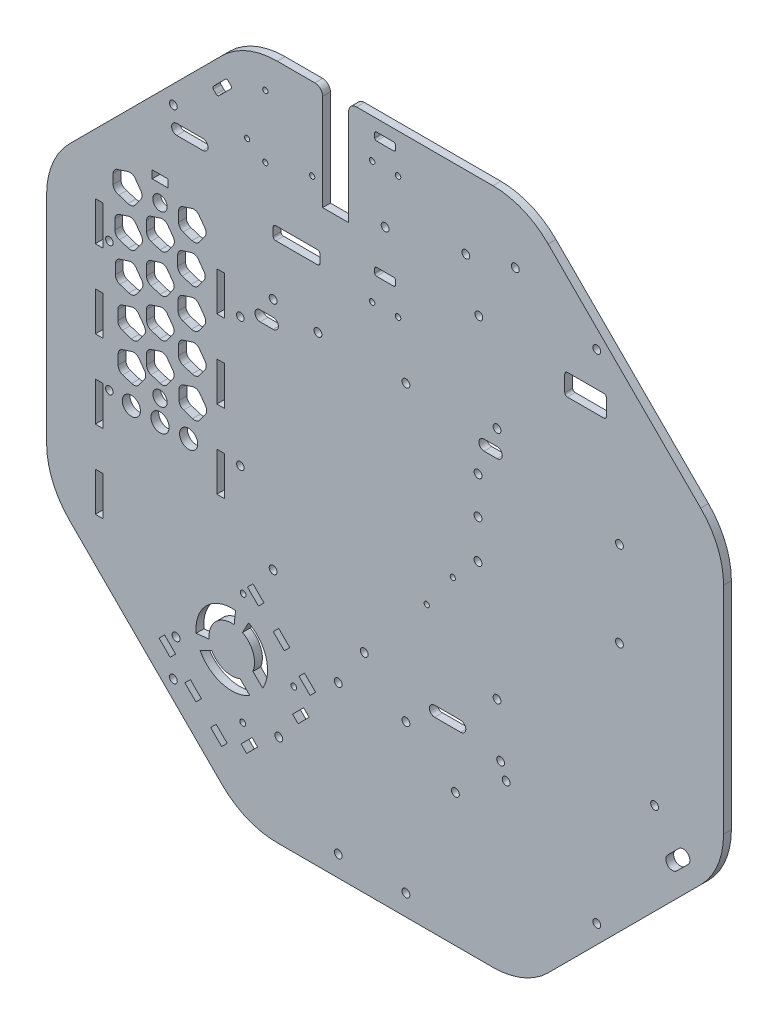
from build123d import *

# Parameters (mm, degrees)
BOSS_EXTRUDE1_DEPTH = 3
SKETCH2_R           = 1.1
SKETCH2_R_2         = 1.5
SKETCH2_R_3         = 2.75
SKETCH2_R_4         = 1.05
SKETCH2_R_5         = 3.5
SKETCH2_W           = 3
SKETCH2_H           = 15
SKETCH2_W_2         = 6
SKETCH2_H_2         = 3
SKETCH2_W_3         = 10
SKETCH2_H_3         = 42
CUT_EXTRUDE2_DEPTH  = 10
FILLET1_R           = 3
SKETCH4_R           = 1.45
SKETCH4_R_2         = 1.5
SKETCH4_W           = 16
SKETCH4_H           = 8.2
SKETCH4_W_2         = 18
SKETCH4_H_2         = 5
CUT_EXTRUDE3_DEPTH  = 10
FILLET2_R           = 1
SKETCH5_R           = 1.5
CUT_EXTRUDE4_DEPTH  = 10
SKETCH6_R           = 1.5
SKETCH6_R_2         = 1
SKETCH6_W           = 8
SKETCH6_H           = 3
CUT_EXTRUDE5_DEPTH  = 10
FILLET3_R           = 1
FILLET4_R           = 0.7


with BuildPart() as part:
    # Sketch1 → Boss-Extrude1 (new body)
    with BuildSketch(Plane.XY):
        with BuildLine():
            Line((130, 17.5), (130, 41.421356237))
            ThreePointArc((130, 41.421356237), (127.716385975, 52.901859208), (121.213203436, 62.634559673))
            Line((121.213203436, 62.634559673), (62.634559673, 121.213203436))
            ThreePointArc((62.634559673, 121.213203436), (52.901859208, 127.716385975), (41.421356237, 130))
            Line((41.421356237, 130), (-41.421356237, 130))
            ThreePointArc((-41.421356237, 130), (-52.901859208, 127.716385975), (-62.634559673, 121.213203436))
            Line((-62.634559673, 121.213203436), (-121.213203436, 62.634559673))
            ThreePointArc((-121.213203436, 62.634559673), (-127.716385975, 52.901859208), (-130, 41.421356237))
            Line((-130, 41.421356237), (-130, 17.5))
            Line((-130, 17.5), (-130, -17.5))
            Line((-130, -17.5), (-130, -41.421356237))
            ThreePointArc((-130, -41.421356237), (-127.716385975, -52.901859208), (-121.213203436, -62.634559673))
            Line((-121.213203436, -62.634559673), (-62.634559673, -121.213203436))
            ThreePointArc((-62.634559673, -121.213203436), (-52.901859208, -127.716385975), (-41.421356237, -130))
            Line((-41.421356237, -130), (41.421356237, -130))
            ThreePointArc((41.421356237, -130), (52.901859208, -127.716385975), (62.634559673, -121.213203436))
            Line((62.634559673, -121.213203436), (121.213203436, -62.634559673))
            ThreePointArc((121.213203436, -62.634559673), (127.716385975, -52.901859208), (130, -41.421356237))
            Line((130, -41.421356237), (130, -17.5))
            Line((130, -17.5), (130, 17.5))
        make_face()
    extrude(amount=BOSS_EXTRUDE1_DEPTH)

    # Sketch2 → Cut-Extrude2 (cut)
    with BuildSketch(Plane.XY):
        with Locations(Location((-80.297278263, -80.932744107, 0), (0, 0, 180))):
            Circle(SKETCH2_R)
        with Locations(Location((-54.662677973, -96.66784946, 0), (0, 0, 180))):
            Circle(SKETCH2_R)
        with Locations(Location((-54.521233727, -53.675780054, 0), (0, 0, 180))):
            Circle(SKETCH2_R)
        with Locations(Location((-35.075797244, -74.818272812, 0), (0, 0, 180))):
            Circle(SKETCH2_R)
        with Locations((-40.840719873, -94.509194306)):
            Circle(SKETCH2_R_2)
        with Locations((-86.456902055, -4.634633752)):
            Circle(SKETCH2_R_3)
        with Locations((-86.456902055, 60.347906666)):
            Circle(SKETCH2_R_3)
        with Locations((4.98, 115)):
            Circle(SKETCH2_R_4)
        with Locations(Location((-4.98, 115, 0), (0, 0, 180))):
            Circle(SKETCH2_R_4)
        with Locations((-4.98, 68.1)):
            Circle(SKETCH2_R_4)
        with Locations(Location((4.98, 68.1, 0), (0, 0, 180))):
            Circle(SKETCH2_R_4)
        with Locations((-97.456902055, -12.652093334)):
            Circle(SKETCH2_R_5)
        with Locations((-75.456902055, -12.652093334)):
            Circle(SKETCH2_R_5)
        with Locations((-86.456902055, -12.652093334)):
            Circle(SKETCH2_R_5)
        with Locations((-63.132453333, 41.847906666)):
            Rectangle(SKETCH2_W, SKETCH2_H)
        with BuildLine():
            Line((-67.578985216, -75.346961612), (-72.551594693, -75.869603929))
            ThreePointArc((-72.551594693, -75.869603929), (-68.601930443, -64.711913429), (-57.446104843, -60.756984843))
            Line((-57.446104843, -60.756984843), (-57.96874725, -65.729595189))
            ThreePointArc((-57.96874725, -65.729595189), (-65.066396383, -68.24744749), (-67.578985216, -75.346961612))
        make_face()
        with BuildLine():
            Line((-66.602710069, -78.540213733), (-71.017448033, -80.887571547))
            ThreePointArc((-71.017448033, -80.887571547), (-62.624240554, -87.661852985), (-51.925173802, -86.295547235))
            Line((-51.925173802, -86.295547235), (-55.653687393, -82.567033643))
            ThreePointArc((-55.653687393, -82.567033643), (-61.897197051, -82.644549092), (-66.602710069, -78.540213733))
        make_face()
        with BuildLine():
            Line((-50.742222547, -77.655568797), (-47.013708955, -81.384082388))
            ThreePointArc((-47.013708955, -81.384082388), (-45.647403205, -70.685015636), (-52.421684643, -62.291808157))
            Line((-52.421684643, -62.291808157), (-54.769042457, -66.706546121))
            ThreePointArc((-54.769042457, -66.706546121), (-50.664707098, -71.412059139), (-50.742222547, -77.655568797))
        make_face()
        Polygon((-53.215088544, -106.176456195), (-55.336408887, -104.055135852), (-51.0937682, -99.812495165), (-48.972447856, -101.933815508), align=None)
        Polygon((-31.294778327, -80.013505292), (-35.537419014, -84.256145979), (-33.41609867, -86.377466322), (-29.173457983, -82.134825635), align=None)
        Polygon((-62.76103009, -108.65132993), (-60.639709746, -106.530009586), (-64.882350433, -102.287368899), (-67.003670777, -104.408689243), align=None)
        Polygon((-72.660525026, -98.751834993), (-76.903165713, -94.509194306), (-74.78184537, -92.387873962), (-70.539204683, -96.630514649), align=None)
        Polygon((-82.560019963, -88.852340056), (-86.80266065, -84.609699369), (-84.681340306, -82.488379026), (-80.438699619, -86.731019713), align=None)
        Polygon((-40.840719873, -58.400041285), (-42.962040216, -60.521361629), (-38.719399529, -64.764002316), (-36.598079186, -62.642681972), align=None)
        Polygon((-50.740214809, -48.500546348), (-52.861535153, -50.621866692), (-48.618894466, -54.864507379), (-46.497574122, -52.743187036), align=None)
        Polygon((-30.941224936, -68.299536222), (-33.06254528, -70.420856565), (-28.819904593, -74.663497252), (-26.698584249, -72.542176909), align=None)
        with Locations((-86.456902055, 68.347906666)):
            Rectangle(SKETCH2_W_2, SKETCH2_H_2)
        with Locations((-109.781350777, 41.847906666)):
            Rectangle(SKETCH2_W, SKETCH2_H)
        with Locations((-109.781350777, 11.847906666)):
            Rectangle(SKETCH2_W, SKETCH2_H)
        with Locations((-109.781350777, -18.152093334)):
            Rectangle(SKETCH2_W, SKETCH2_H)
        with Locations((-109.781350777, -48.152093334)):
            Rectangle(SKETCH2_W, SKETCH2_H)
        with Locations((-63.132453333, 11.847906666)):
            Rectangle(SKETCH2_W, SKETCH2_H)
        with Locations((-63.132453333, -18.152093334)):
            Rectangle(SKETCH2_W, SKETCH2_H)
        with BuildLine():
            Line((-93.838836996, 60.750802244), (-95.974091911, 63.689728506))
            ThreePointArc((-95.974091911, 63.689728506), (-97.224091911, 64.597906666), (-98.769176883, 64.597906666))
            Line((-98.769176883, 64.597906666), (-102.224091911, 63.475336724))
            ThreePointArc((-102.224091911, 63.475336724), (-103.785893768, 62.702847203), (-104.46372332, 61.097695434))
            Line((-104.46372332, 61.097695434), (-104.46372332, 57.464982794))
            ThreePointArc((-104.46372332, 57.464982794), (-103.790493058, 55.863487753), (-102.236265805, 55.087341503))
            Line((-102.236265805, 55.087341503), (-98.781350777, 53.964771561))
            ThreePointArc((-98.781350777, 53.964771561), (-97.236265805, 53.964771561), (-95.986265805, 54.872949721))
            Line((-95.986265805, 54.872949721), (-93.85101089, 57.811875983))
            ThreePointArc((-93.85101089, 57.811875983), (-93.367461365, 59.279361324), (-93.838836996, 60.750802244))
        make_face()
        with BuildLine():
            Line((-93.668638348, 45.96766714), (-95.803893263, 48.906593401))
            ThreePointArc((-95.803893263, 48.906593401), (-97.053893263, 49.814771561), (-98.598978235, 49.814771561))
            Line((-98.598978235, 49.814771561), (-102.053893263, 48.69220162))
            ThreePointArc((-102.053893263, 48.69220162), (-103.303893263, 47.78402346), (-103.781350777, 46.314560329))
            Line((-103.781350777, 46.314560329), (-103.781350777, 42.681847689))
            ThreePointArc((-103.781350777, 42.681847689), (-103.303893263, 41.212384559), (-102.053893263, 40.304206399))
            Line((-102.053893263, 40.304206399), (-98.598978235, 39.181636457))
            ThreePointArc((-98.598978235, 39.181636457), (-97.053893263, 39.181636457), (-95.803893263, 40.089814617))
            Line((-95.803893263, 40.089814617), (-93.668638348, 43.028740879))
            ThreePointArc((-93.668638348, 43.028740879), (-93.191180834, 44.498204009), (-93.668638348, 45.96766714))
        make_face()
        with BuildLine():
            Line((-93.486265805, 31.184532036), (-95.621520721, 34.123458297))
            ThreePointArc((-95.621520721, 34.123458297), (-96.871520721, 35.031636457), (-98.416605693, 35.031636457))
            Line((-98.416605693, 35.031636457), (-101.871520721, 33.909066516))
            ThreePointArc((-101.871520721, 33.909066516), (-103.121520721, 33.000888356), (-103.598978235, 31.531425225))
            Line((-103.598978235, 31.531425225), (-103.598978235, 27.898712585))
            ThreePointArc((-103.598978235, 27.898712585), (-103.121520721, 26.429249454), (-101.871520721, 25.521071294))
            Line((-101.871520721, 25.521071294), (-98.416605693, 24.398501353))
            ThreePointArc((-98.416605693, 24.398501353), (-96.871520721, 24.398501353), (-95.621520721, 25.306679513))
            Line((-95.621520721, 25.306679513), (-93.486265805, 28.245605774))
            ThreePointArc((-93.486265805, 28.245605774), (-93.008808291, 29.715068905), (-93.486265805, 31.184532036))
        make_face()
        with BuildLine():
            Line((-92.531350777, 16.401396931), (-94.666605693, 19.340323193))
            ThreePointArc((-94.666605693, 19.340323193), (-95.916605693, 20.248501353), (-97.461690665, 20.248501353))
            Line((-97.461690665, 20.248501353), (-100.916605693, 19.125931411))
            ThreePointArc((-100.916605693, 19.125931411), (-102.166605693, 18.217753251), (-102.644063207, 16.74829012))
            Line((-102.644063207, 16.74829012), (-102.644063207, 13.11557748))
            ThreePointArc((-102.644063207, 13.11557748), (-102.166605693, 11.64611435), (-100.916605693, 10.73793619))
            Line((-100.916605693, 10.73793619), (-97.461690665, 9.615366248))
            ThreePointArc((-97.461690665, 9.615366248), (-95.916605693, 9.615366248), (-94.666605693, 10.523544408))
            Line((-94.666605693, 10.523544408), (-92.531350777, 13.46247067))
            ThreePointArc((-92.531350777, 13.46247067), (-92.053893263, 14.9319338), (-92.531350777, 16.401396931))
        make_face()
        with BuildLine():
            Line((-92.405382528, 1.620174075), (-94.540637444, 4.559100336))
            ThreePointArc((-94.540637444, 4.559100336), (-95.790637444, 5.467278496), (-97.335722415, 5.467278496))
            Line((-97.335722415, 5.467278496), (-100.790637444, 4.344708555))
            ThreePointArc((-100.790637444, 4.344708555), (-102.040637444, 3.436530395), (-102.518094958, 1.967067264))
            Line((-102.518094958, 1.967067264), (-102.518094958, -1.665645376))
            ThreePointArc((-102.518094958, -1.665645376), (-102.040637444, -3.135108507), (-100.790637444, -4.043286667))
            Line((-100.790637444, -4.043286667), (-97.335722415, -5.165856608))
            ThreePointArc((-97.335722415, -5.165856608), (-95.790637444, -5.165856608), (-94.540637444, -4.257678448))
            Line((-94.540637444, -4.257678448), (-92.405382528, -1.318752187))
            ThreePointArc((-92.405382528, -1.318752187), (-91.927925014, 0.150710944), (-92.405382528, 1.620174075))
        make_face()
        with BuildLine():
            Line((-69.306725976, 60.750802244), (-71.441980891, 63.689728506))
            ThreePointArc((-71.441980891, 63.689728506), (-72.691980891, 64.597906666), (-74.237065863, 64.597906666))
            Line((-74.237065863, 64.597906666), (-77.691980891, 63.475336724))
            ThreePointArc((-77.691980891, 63.475336724), (-78.879962413, 62.543534215), (-79.314825876, 61.097695434))
            Line((-79.314825876, 61.097695434), (-79.314825876, 57.464982794))
            ThreePointArc((-79.314825876, 57.464982794), (-78.837368362, 55.995519663), (-77.587368362, 55.087341503))
            Line((-77.587368362, 55.087341503), (-74.132453333, 53.964771561))
            ThreePointArc((-74.132453333, 53.964771561), (-72.587368362, 53.964771561), (-71.337368362, 54.872949721))
            Line((-71.337368362, 54.872949721), (-69.202113446, 57.811875983))
            ThreePointArc((-69.202113446, 57.811875983), (-68.77658834, 59.298347757), (-69.306725976, 60.750802244))
        make_face()
        with BuildLine():
            Line((-69.56452041, 45.96766714), (-71.699775326, 48.906593401))
            ThreePointArc((-71.699775326, 48.906593401), (-72.949775326, 49.814771561), (-74.494860298, 49.814771561))
            Line((-74.494860298, 49.814771561), (-77.949775326, 48.69220162))
            ThreePointArc((-77.949775326, 48.69220162), (-79.199775326, 47.78402346), (-79.67723284, 46.314560329))
            Line((-79.67723284, 46.314560329), (-79.67723284, 42.681847689))
            ThreePointArc((-79.67723284, 42.681847689), (-79.199775326, 41.212384559), (-77.949775326, 40.304206399))
            Line((-77.949775326, 40.304206399), (-74.494860298, 39.181636457))
            ThreePointArc((-74.494860298, 39.181636457), (-72.949775326, 39.181636457), (-71.699775326, 40.089814617))
            Line((-71.699775326, 40.089814617), (-69.56452041, 43.028740879))
            ThreePointArc((-69.56452041, 43.028740879), (-69.087062896, 44.498204009), (-69.56452041, 45.96766714))
        make_face()
        with BuildLine():
            Line((-69.382147868, 31.184532036), (-71.517402784, 34.123458297))
            ThreePointArc((-71.517402784, 34.123458297), (-72.767402784, 35.031636457), (-74.312487756, 35.031636457))
            Line((-74.312487756, 35.031636457), (-77.767402784, 33.909066516))
            ThreePointArc((-77.767402784, 33.909066516), (-79.017402784, 33.000888356), (-79.494860298, 31.531425225))
            Line((-79.494860298, 31.531425225), (-79.494860298, 27.898712585))
            ThreePointArc((-79.494860298, 27.898712585), (-79.017402784, 26.429249454), (-77.767402784, 25.521071294))
            Line((-77.767402784, 25.521071294), (-74.312487756, 24.398501353))
            ThreePointArc((-74.312487756, 24.398501353), (-72.767402784, 24.398501353), (-71.517402784, 25.306679513))
            Line((-71.517402784, 25.306679513), (-69.382147868, 28.245605774))
            ThreePointArc((-69.382147868, 28.245605774), (-68.904690354, 29.715068905), (-69.382147868, 31.184532036))
        make_face()
        with BuildLine():
            Line((-69.199775326, 16.401396931), (-71.335030242, 19.340323193))
            ThreePointArc((-71.335030242, 19.340323193), (-72.585030242, 20.248501353), (-74.130115214, 20.248501353))
            Line((-74.130115214, 20.248501353), (-77.585030242, 19.125931411))
            ThreePointArc((-77.585030242, 19.125931411), (-78.835030242, 18.217753251), (-79.312487756, 16.74829012))
            Line((-79.312487756, 16.74829012), (-79.312487756, 13.11557748))
            ThreePointArc((-79.312487756, 13.11557748), (-78.835030242, 11.64611435), (-77.585030242, 10.73793619))
            Line((-77.585030242, 10.73793619), (-74.130115214, 9.615366248))
            ThreePointArc((-74.130115214, 9.615366248), (-72.585030242, 9.615366248), (-71.335030242, 10.523544408))
            Line((-71.335030242, 10.523544408), (-69.199775326, 13.46247067))
            ThreePointArc((-69.199775326, 13.46247067), (-68.722317812, 14.9319338), (-69.199775326, 16.401396931))
        make_face()
        with BuildLine():
            Line((-69.017402784, 1.618261827), (-71.1526577, 4.557188088))
            ThreePointArc((-71.1526577, 4.557188088), (-72.4026577, 5.465366248), (-73.947742671, 5.465366248))
            Line((-73.947742671, 5.465366248), (-77.4026577, 4.342796307))
            ThreePointArc((-77.4026577, 4.342796307), (-78.6526577, 3.434618147), (-79.130115214, 1.965155016))
            Line((-79.130115214, 1.965155016), (-79.130115214, -1.667557624))
            ThreePointArc((-79.130115214, -1.667557624), (-78.6526577, -3.137020755), (-77.4026577, -4.045198915))
            Line((-77.4026577, -4.045198915), (-73.947742671, -5.167768856))
            ThreePointArc((-73.947742671, -5.167768856), (-72.4026577, -5.167768856), (-71.1526577, -4.259590696))
            Line((-71.1526577, -4.259590696), (-69.017402784, -1.320664435))
            ThreePointArc((-69.017402784, -1.320664435), (-68.53994527, 0.148798696), (-69.017402784, 1.618261827))
        make_face()
        with BuildLine():
            Line((-81.344189626, 51.500802244), (-83.479444541, 54.439728506))
            ThreePointArc((-83.479444541, 54.439728506), (-84.729444541, 55.347906666), (-86.274529513, 55.347906666))
            Line((-86.274529513, 55.347906666), (-89.729444541, 54.225336724))
            ThreePointArc((-89.729444541, 54.225336724), (-91.088894263, 53.361456818), (-91.639274598, 51.847695434))
            Line((-91.639274598, 51.847695434), (-91.639274598, 48.214982794))
            ThreePointArc((-91.639274598, 48.214982794), (-91.161817083, 46.745519663), (-89.911817084, 45.837341503))
            Line((-89.911817084, 45.837341503), (-86.456902055, 44.714771561))
            ThreePointArc((-86.456902055, 44.714771561), (-84.911817084, 44.714771561), (-83.661817084, 45.622949721))
            Line((-83.661817084, 45.622949721), (-81.526562168, 48.561875983))
            ThreePointArc((-81.526562168, 48.561875983), (-80.95678235, 50.001640403), (-81.344189626, 51.500802244))
        make_face()
        with BuildLine():
            Line((-81.526562168, 36.71766714), (-83.661817084, 39.656593401))
            ThreePointArc((-83.661817084, 39.656593401), (-84.911817084, 40.564771561), (-86.456902055, 40.564771561))
            Line((-86.456902055, 40.564771561), (-89.911817084, 39.44220162))
            ThreePointArc((-89.911817084, 39.44220162), (-91.161817084, 38.53402346), (-91.639274598, 37.064560329))
            Line((-91.639274598, 37.064560329), (-91.639274598, 33.431847689))
            ThreePointArc((-91.639274598, 33.431847689), (-91.161817084, 31.962384559), (-89.911817084, 31.054206399))
            Line((-89.911817084, 31.054206399), (-86.456902055, 29.931636457))
            ThreePointArc((-86.456902055, 29.931636457), (-84.911817084, 29.931636457), (-83.661817084, 30.839814617))
            Line((-83.661817084, 30.839814617), (-81.526562168, 33.778740879))
            ThreePointArc((-81.526562168, 33.778740879), (-81.049104654, 35.248204009), (-81.526562168, 36.71766714))
        make_face()
        with BuildLine():
            Line((-81.526562168, 21.934532036), (-83.661817084, 24.873458297))
            ThreePointArc((-83.661817084, 24.873458297), (-84.911817084, 25.781636457), (-86.456902055, 25.781636457))
            Line((-86.456902055, 25.781636457), (-89.911817084, 24.659066516))
            ThreePointArc((-89.911817084, 24.659066516), (-91.161817084, 23.750888356), (-91.639274598, 22.281425225))
            Line((-91.639274598, 22.281425225), (-91.639274598, 18.648712585))
            ThreePointArc((-91.639274598, 18.648712585), (-91.161817084, 17.179249454), (-89.911817084, 16.271071294))
            Line((-89.911817084, 16.271071294), (-86.456902055, 15.148501353))
            ThreePointArc((-86.456902055, 15.148501353), (-84.911817084, 15.148501353), (-83.661817084, 16.056679513))
            Line((-83.661817084, 16.056679513), (-81.526562168, 18.995605774))
            ThreePointArc((-81.526562168, 18.995605774), (-81.049104654, 20.465068905), (-81.526562168, 21.934532036))
        make_face()
        with BuildLine():
            Line((-81.526562168, 7.151396931), (-83.661817084, 10.090323193))
            ThreePointArc((-83.661817084, 10.090323193), (-84.911817084, 10.998501353), (-86.456902055, 10.998501353))
            Line((-86.456902055, 10.998501353), (-89.911817084, 9.875931411))
            ThreePointArc((-89.911817084, 9.875931411), (-91.161817084, 8.967753251), (-91.639274598, 7.49829012))
            Line((-91.639274598, 7.49829012), (-91.639274598, 3.86557748))
            ThreePointArc((-91.639274598, 3.86557748), (-91.161817084, 2.39611435), (-89.911817084, 1.48793619))
            Line((-89.911817084, 1.48793619), (-86.456902055, 0.365366248))
            ThreePointArc((-86.456902055, 0.365366248), (-84.911817084, 0.365366248), (-83.661817084, 1.273544408))
            Line((-83.661817084, 1.273544408), (-81.526562168, 4.21247067))
            ThreePointArc((-81.526562168, 4.21247067), (-81.049104654, 5.6819338), (-81.526562168, 7.151396931))
        make_face()
        with Locations((-19, 111)):
            Rectangle(SKETCH2_W_3, SKETCH2_H_3)
    extrude(amount=CUT_EXTRUDE2_DEPTH, mode=Mode.SUBTRACT)

    # Fillet1
    fillet1_edges = [part.edges().sort_by_distance(p)[0] for p in [
        (-14, 130, 1.5),
        (-24, 130, 1.5),
    ]]
    fillet(fillet1_edges, radius=FILLET1_R)

    # Sketch4 → Cut-Extrude3 (cut)
    with BuildSketch(Plane.XY.offset(3)):
        with Locations((-105.9, 37.94)):
            Circle(SKETCH4_R)
        with Locations((-55.6, 37.94)):
            Circle(SKETCH4_R)
        with Locations((-105.9, -11.7)):
            Circle(SKETCH4_R)
        with Locations((-55.6, -11.7)):
            Circle(SKETCH4_R)
        with Locations((44.368675668, -59.95260387)):
            Circle(SKETCH4_R_2)
        with Locations((103.498675668, -45.10260387)):
            Circle(SKETCH4_R_2)
        with Locations((77, 78.1)):
            Rectangle(SKETCH4_W, SKETCH4_H)
        with Locations((-34, 72.5)):
            Rectangle(SKETCH4_W_2, SKETCH4_H_2)
    extrude(amount=-CUT_EXTRUDE3_DEPTH, mode=Mode.SUBTRACT)

    # Fillet2
    fillet2_edges = [part.edges().sort_by_distance(p)[0] for p in [
        (-25, 75, 1.5),
        (-25, 70, 1.5),
        (-43, 70, 1.5),
        (-43, 75, 1.5),
    ]]
    fillet(fillet2_edges, radius=FILLET2_R)

    # Sketch5 → Cut-Extrude4 (cut)
    with BuildSketch(Plane.XY.offset(3)):
        with Locations((90, 35)):
            Circle(SKETCH5_R)
        with Locations((90, 2.13)):
            Circle(SKETCH5_R)
        with Locations((-18, -65)):
            Circle(SKETCH5_R)
        with Locations((8, -122)):
            Circle(SKETCH5_R)
        with Locations((-18, -122)):
            Circle(SKETCH5_R)
        with Locations((8, -65)):
            Circle(SKETCH5_R)
        with Locations((46.5, -65.5)):
            Circle(SKETCH5_R)
        with Locations((27, -79)):
            Circle(SKETCH5_R)
        with Locations((-8, -50)):
            Circle(SKETCH5_R)
        with Locations((-80.297278263, -80.932744107)):
            Circle(SKETCH5_R)
        with Locations((8, 47.591465448)):
            Circle(SKETCH5_R)
        with Locations((-25.776936604, 47.591465448)):
            Circle(SKETCH5_R)
        with Locations((35.693959576, 31.269948624)):
            Circle(SKETCH5_R)
        with Locations((35.693959576, 16.992846182)):
            Circle(SKETCH5_R)
        with Locations((35.693959576, 2.13)):
            Circle(SKETCH5_R)
        with BuildLine():
            Line((19, -54), (29, -54))
            ThreePointArc((29, -54), (31, -56), (29, -58))
            Line((29, -58), (19, -58))
            ThreePointArc((19, -58), (17, -56), (19, -54))
        make_face()
        with BuildLine():
            Line((-80, 90), (-70, 90))
            ThreePointArc((-70, 90), (-68, 88), (-70, 86))
            Line((-70, 86), (-80, 86))
            ThreePointArc((-80, 86), (-82, 88), (-80, 90))
        make_face()
    extrude(amount=-CUT_EXTRUDE4_DEPTH, mode=Mode.SUBTRACT)

    # Sketch6 → Cut-Extrude5 (cut)
    with BuildSketch(Plane.XY.offset(3)):
        with Locations((-43, -40)):
            Circle(SKETCH6_R)
        with Locations((-43, 50)):
            Circle(SKETCH6_R)
        with Locations((43, -40)):
            Circle(SKETCH6_R)
        with Locations((43, 50)):
            Circle(SKETCH6_R)
        with Locations((-81.317279836, -95.45941546)):
            Circle(SKETCH6_R)
        with Locations((81.317279836, -95.45941546)):
            Circle(SKETCH6_R)
        with Locations((81.317279836, 95.45941546)):
            Circle(SKETCH6_R)
        with Locations((-81.317279836, 95.45941546)):
            Circle(SKETCH6_R)
        with Locations((16, -22)):
            Circle(SKETCH6_R_2)
        with Locations((26, -8)):
            Circle(SKETCH6_R_2)
        with Locations((31, 102)):
            Circle(SKETCH6_R)
        with Locations((50, 107)):
            Circle(SKETCH6_R)
        with Locations((36, 84)):
            Circle(SKETCH6_R)
        with Locations((-28, 98.5)):
            Circle(SKETCH6_R_2)
        with Locations((-53, 98.5)):
            Circle(SKETCH6_R_2)
        with Locations((-46, 118)):
            Circle(SKETCH6_R_2)
        with Locations((-46, 94)):
            Circle(SKETCH6_R_2)
        with Locations((0, 95.5)):
            Circle(SKETCH6_R)
        Polygon((-58.689862838, 112.429978209), (-64.346717088, 106.773123959), (-66.468037432, 108.894444303), (-60.811183182, 114.551298552), align=None)
        with BuildLine():
            Line((-43, 40), (-48, 40))
            ThreePointArc((-48, 40), (-50, 42), (-48, 44))
            Line((-48, 44), (-43, 44))
            ThreePointArc((-43, 44), (-41, 42), (-43, 40))
        make_face()
        with BuildLine():
            Line((43, 40), (38, 40))
            ThreePointArc((38, 40), (36, 42), (38, 44))
            Line((38, 44), (43, 44))
            ThreePointArc((43, 44), (45, 42), (43, 40))
        make_face()
        with Locations((0, 124)):
            Rectangle(SKETCH6_W, SKETCH6_H)
        with Locations((0, 79)):
            Rectangle(SKETCH6_W, SKETCH6_H)
        with BuildLine():
            Line((116.319065505, -58.336309448), (112.076424818, -62.578950135))
            ThreePointArc((112.076424818, -62.578950135), (108.540890912, -62.578950135), (108.540890912, -59.043416229))
            Line((108.540890912, -59.043416229), (112.783531599, -54.800775542))
            ThreePointArc((112.783531599, -54.800775542), (116.319065505, -54.800775542), (116.319065505, -58.336309448))
        make_face()
    extrude(amount=-CUT_EXTRUDE5_DEPTH, mode=Mode.SUBTRACT)

    # Fillet3
    fillet3_edges = [part.edges().sort_by_distance(p)[0] for p in [
        (85, 82.2, 1.5),
        (85, 74, 1.5),
        (69, 74, 1.5),
        (69, 82.2, 1.5),
    ]]
    fillet(fillet3_edges, radius=FILLET3_R)

    # Fillet4
    fillet4_edges = [part.edges().sort_by_distance(p)[0] for p in [
        (4, 125.5, 1.5),
        (4, 122.5, 1.5),
        (-4, 122.5, 1.5),
        (-4, 125.5, 1.5),
        (-4, 77.5, 1.5),
        (-4, 80.5, 1.5),
        (4, 80.5, 1.5),
        (4, 77.5, 1.5),
        (-60.811183182, 114.551298552, 1.5),
        (-58.689862838, 112.429978209, 1.5),
        (-64.346717088, 106.773123959, 1.5),
        (-66.468037432, 108.894444303, 1.5),
    ]]
    fillet(fillet4_edges, radius=FILLET4_R)


solid = part.part
